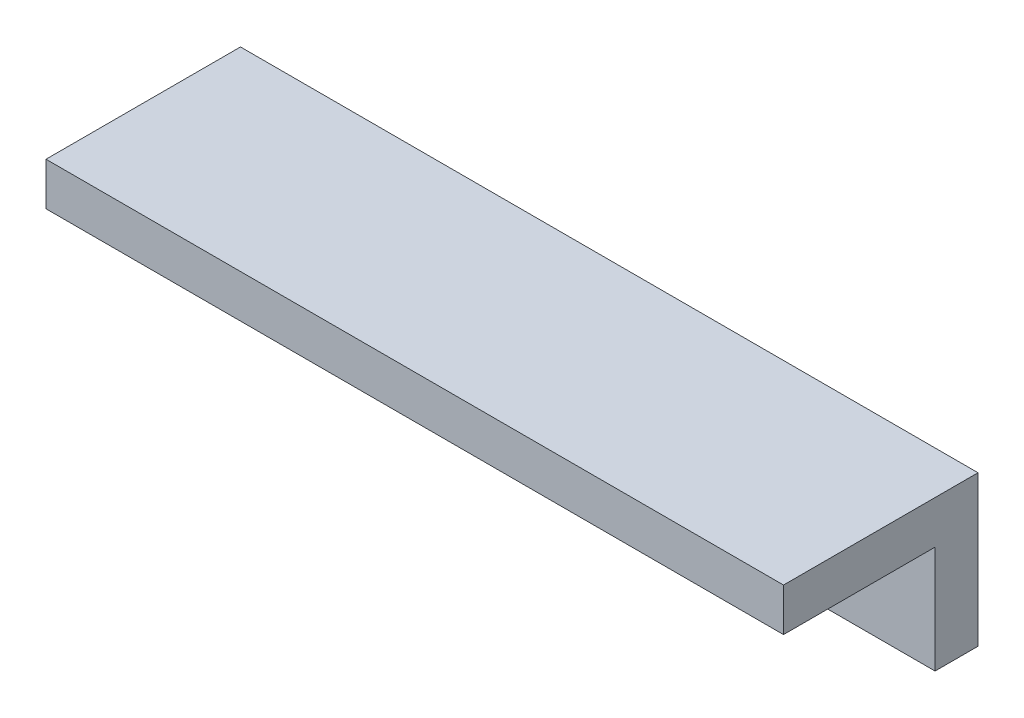
from build123d import *

# Parameters (mm, degrees)
FEMALE_MATING_FOOT_VERIFY_START                = 34.6
SKETCH_1_W                                     = 58.4
SKETCH_1_H                                     = 11.9
FEMALE_MATING_FOOT_VERIFY_DEPTH                = 3.4
RIGHT_ANGLE_SOCKET_INFERRED_NOT_CERTIFIE_START = 38
SKETCH_2_W                                     = 58.4
SKETCH_2_H                                     = 3.4
RIGHT_ANGLE_SOCKET_INFERRED_NOT_CERTIFIE_DEPTH = 12


with BuildPart() as part:
    # 草图1 → Female_mating_foot_VERIFY (new body)
    with BuildSketch(Plane.XY.offset(FEMALE_MATING_FOOT_VERIFY_START)):
        with Locations((0, -135.95)):
            Rectangle(SKETCH_1_W, SKETCH_1_H)
    extrude(amount=FEMALE_MATING_FOOT_VERIFY_DEPTH)

    # 草图2 → Right_angle_socket_INFERRED_NOT_CERTIFIED (add)
    with BuildSketch(Plane.XY.offset(RIGHT_ANGLE_SOCKET_INFERRED_NOT_CERTIFIE_START)):
        with Locations((0, -131.7)):
            Rectangle(SKETCH_2_W, SKETCH_2_H)
    extrude(amount=RIGHT_ANGLE_SOCKET_INFERRED_NOT_CERTIFIE_DEPTH)


solid = part.part
